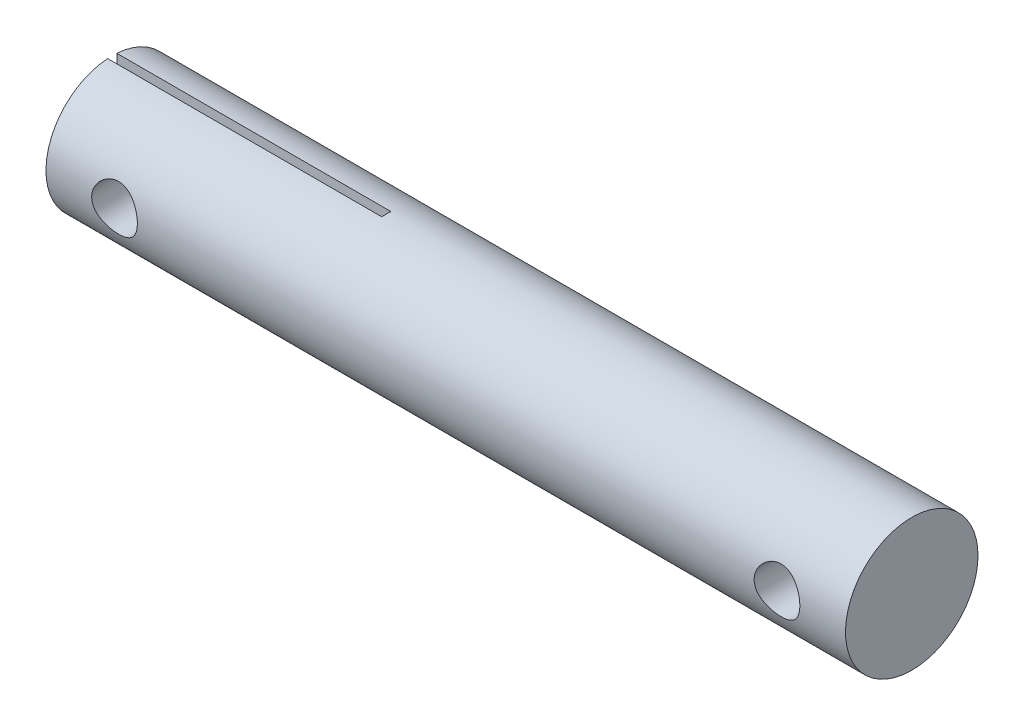
from build123d import *

# Parameters (mm, degrees)
SKETCH_1_R               = 2.9
EXTRUDE_1_DEPTH          = 35
SKETCH_2_W               = 0.4
SKETCH_2_H               = 5.450532248
CUT_EXTRUDE_1_DEPTH      = 12
CUT_EXTRUDE_2_DEPTH      = 10
CUT_EXTRUDE_2_DEPTH_BACK = 10
SKETCH_3_R               = 1


with BuildPart() as part:
    # 草图1 → 凸台-拉伸1 (new body)
    with BuildSketch(Plane(origin=(0, 0, 0), x_dir=(0, 0, -1), z_dir=(1, 0, 0))):
        Circle(SKETCH_1_R)
    extrude(amount=EXTRUDE_1_DEPTH)

    # 草图2 → 切除-拉伸1 (cut)
    with BuildSketch(Plane.ZY):
        with Locations((0, 0.396255312)):
            Rectangle(SKETCH_2_W, SKETCH_2_H)
    extrude(amount=-CUT_EXTRUDE_1_DEPTH, mode=Mode.SUBTRACT)

    # 草图3 → 切除-拉伸2 (cut, two sides: drawn at the far end of the back side and taken through both)
    with BuildSketch(Plane(origin=(0, 0, 0.2), x_dir=(-1, 0, 0), z_dir=(0, 0, -1)).offset(-CUT_EXTRUDE_2_DEPTH_BACK)):
        with Locations(Location((-3, -0.003452386, 0), (0, 0, 270))):
            Circle(SKETCH_3_R)
        with Locations(Location((-32, -0.003452386, 0), (0, 0, 270))):
            Circle(SKETCH_3_R)
    extrude(amount=CUT_EXTRUDE_2_DEPTH + CUT_EXTRUDE_2_DEPTH_BACK, mode=Mode.SUBTRACT)


solid = part.part
